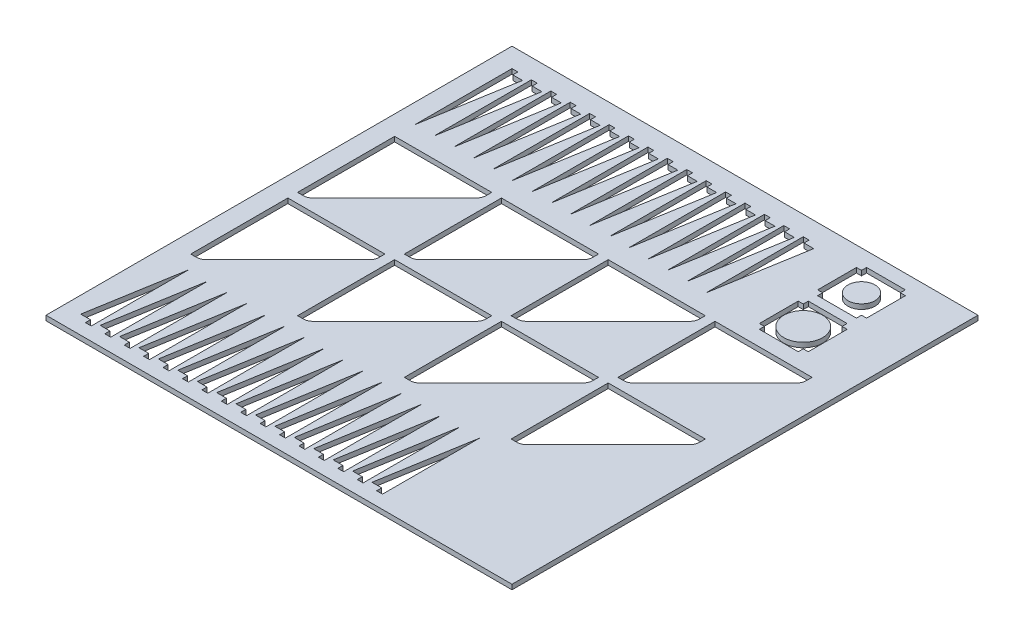
from build123d import *

# Parameters (mm, degrees)
SKETCH2_W               = 304.8
SKETCH2_H               = 304.8
BOSS_EXTRUDE1_DEPTH     = 3.175
CUT_EXTRUDE1_DEPTH      = 348.408852067
CUT_EXTRUDE1_DEPTH_BACK = 348.408852067
SKETCH3_R               = 8.89
SKETCH3_R_2             = 12.7


with BuildPart() as part:
    # Sketch2 → Boss-Extrude1 (new body)
    with BuildSketch(Plane(origin=(0, 0, 0), x_dir=(1, 0, 0), z_dir=(0, 1, 0))):
        with Locations((-56.763509666, -124.968808797)):
            Rectangle(SKETCH2_W, SKETCH2_H)
    extrude(amount=BOSS_EXTRUDE1_DEPTH)

    # Sketch3 → Cut-Extrude1 (cut, two sides: drawn at the far end of the back side and taken through both)
    # profile 1 of 42: a face of its own
    with BuildSketch(Plane(origin=(0, 3.175, 0), x_dir=(1, 0, 0), z_dir=(0, 1, 0)).offset(-CUT_EXTRUDE1_DEPTH_BACK)):
        Polygon((57.536490334, -10.668808797), (57.536490334, -13.970808797), (32.136490334, -13.970808797), (32.136490334, -10.668808797), (28.834490334, -10.668808797), (28.834490334, 14.731191203), (32.136490334, 14.731191203), (32.136490334, 18.033191203), (57.536490334, 18.033191203), (57.536490334, 14.731191203), (60.838490334, 14.731191203), (60.838490334, -10.668808797), align=None)
        with Locations(Location((44.836490334, 2.031191203, 0), (0, 0, 270))):
            Circle(SKETCH3_R, mode=Mode.SUBTRACT)
    # profile 2 of 42: a face of its own
    with BuildSketch(Plane(origin=(0, 3.175, 0), x_dir=(1, 0, 0), z_dir=(0, 1, 0)).offset(-CUT_EXTRUDE1_DEPTH_BACK)):
        Polygon((32.136490334, -23.368808797), (28.834490334, -23.368808797), (28.834490334, -48.768808797), (32.136490334, -48.768808797), (32.136490334, -52.070808797), (57.536490334, -52.070808797), (57.536490334, -48.768808797), (60.838490334, -48.768808797), (60.838490334, -23.368808797), (57.536490334, -23.368808797), (57.536490334, -20.066808797), (32.136490334, -20.066808797), align=None)
        with Locations(Location((44.836490334, -36.068808797, 0), (0, 0, 270))):
            Circle(SKETCH3_R_2, mode=Mode.SUBTRACT)
    # profile 3 of 42: a face of its own
    with BuildSketch(Plane(origin=(0, 3.175, 0), x_dir=(1, 0, 0), z_dir=(0, 1, 0)).offset(-CUT_EXTRUDE1_DEPTH_BACK)):
        Polygon((-196.463509666, -48.768808797), (-186.303509666, 11.429191203), (-192.653509666, 11.429191203), (-192.653509666, 14.731191203), (-196.463509666, 14.731191203), align=None)
    # profile 4 of 42: a face of its own
    with BuildSketch(Plane(origin=(0, 3.175, 0), x_dir=(1, 0, 0), z_dir=(0, 1, 0)).offset(-CUT_EXTRUDE1_DEPTH_BACK)):
        Polygon((2.246362274, -205.195366412), (-7.913637726, -265.393366412), (-1.563637726, -265.393366412), (-1.563637726, -268.695366412), (2.246362274, -268.695366412), align=None)
    # profile 5 of 42: a face of its own
    with BuildSketch(Plane(origin=(0, 3.175, 0), x_dir=(1, 0, 0), z_dir=(0, 1, 0)).offset(-CUT_EXTRUDE1_DEPTH_BACK)):
        Polygon((-183.763509666, 14.731191203), (-183.763509666, -48.768808797), (-173.603509666, 11.429191203), (-179.953509666, 11.429191203), (-179.953509666, 14.731191203), align=None)
    # profile 6 of 42: a face of its own
    with BuildSketch(Plane(origin=(0, 3.175, 0), x_dir=(1, 0, 0), z_dir=(0, 1, 0)).offset(-CUT_EXTRUDE1_DEPTH_BACK)):
        Polygon((-10.453637726, -205.195366412), (-20.613637726, -265.393366412), (-14.263637726, -265.393366412), (-14.263637726, -268.695366412), (-10.453637726, -268.695366412), align=None)
    # profile 7 of 42: a face of its own
    with BuildSketch(Plane(origin=(0, 3.175, 0), x_dir=(1, 0, 0), z_dir=(0, 1, 0)).offset(-CUT_EXTRUDE1_DEPTH_BACK)):
        Polygon((-171.063509666, 14.731191203), (-171.063509666, -48.768808797), (-160.903509666, 11.429191203), (-167.253509666, 11.429191203), (-167.253509666, 14.731191203), align=None)
    # profile 8 of 42: a face of its own
    with BuildSketch(Plane(origin=(0, 3.175, 0), x_dir=(1, 0, 0), z_dir=(0, 1, 0)).offset(-CUT_EXTRUDE1_DEPTH_BACK)):
        Polygon((-23.153637726, -205.195366412), (-33.313637726, -265.393366412), (-26.963637726, -265.393366412), (-26.963637726, -268.695366412), (-23.153637726, -268.695366412), align=None)
    # profile 9 of 42: a face of its own
    with BuildSketch(Plane(origin=(0, 3.175, 0), x_dir=(1, 0, 0), z_dir=(0, 1, 0)).offset(-CUT_EXTRUDE1_DEPTH_BACK)):
        Polygon((-158.363509666, 14.731191203), (-158.363509666, -48.768808797), (-148.203509666, 11.429191203), (-154.553509666, 11.429191203), (-154.553509666, 14.731191203), align=None)
    # profile 10 of 42: a face of its own
    with BuildSketch(Plane(origin=(0, 3.175, 0), x_dir=(1, 0, 0), z_dir=(0, 1, 0)).offset(-CUT_EXTRUDE1_DEPTH_BACK)):
        Polygon((-35.853637726, -205.195366412), (-46.013637726, -265.393366412), (-39.663637726, -265.393366412), (-39.663637726, -268.695366412), (-35.853637726, -268.695366412), align=None)
    # profile 11 of 42: a face of its own
    with BuildSketch(Plane(origin=(0, 3.175, 0), x_dir=(1, 0, 0), z_dir=(0, 1, 0)).offset(-CUT_EXTRUDE1_DEPTH_BACK)):
        Polygon((-145.663509666, 14.731191203), (-145.663509666, -48.768808797), (-135.503509666, 11.429191203), (-141.853509666, 11.429191203), (-141.853509666, 14.731191203), align=None)
    # profile 12 of 42: a face of its own
    with BuildSketch(Plane(origin=(0, 3.175, 0), x_dir=(1, 0, 0), z_dir=(0, 1, 0)).offset(-CUT_EXTRUDE1_DEPTH_BACK)):
        Polygon((-48.553637726, -205.195366412), (-58.713637726, -265.393366412), (-52.363637726, -265.393366412), (-52.363637726, -268.695366412), (-48.553637726, -268.695366412), align=None)
    # profile 13 of 42: a face of its own
    with BuildSketch(Plane(origin=(0, 3.175, 0), x_dir=(1, 0, 0), z_dir=(0, 1, 0)).offset(-CUT_EXTRUDE1_DEPTH_BACK)):
        Polygon((-132.963509666, 14.731191203), (-132.963509666, -48.768808797), (-122.803509666, 11.429191203), (-129.153509666, 11.429191203), (-129.153509666, 14.731191203), align=None)
    # profile 14 of 42: a face of its own
    with BuildSketch(Plane(origin=(0, 3.175, 0), x_dir=(1, 0, 0), z_dir=(0, 1, 0)).offset(-CUT_EXTRUDE1_DEPTH_BACK)):
        Polygon((-61.253637726, -205.195366412), (-71.413637726, -265.393366412), (-65.063637726, -265.393366412), (-65.063637726, -268.695366412), (-61.253637726, -268.695366412), align=None)
    # profile 15 of 42: a face of its own
    with BuildSketch(Plane(origin=(0, 3.175, 0), x_dir=(1, 0, 0), z_dir=(0, 1, 0)).offset(-CUT_EXTRUDE1_DEPTH_BACK)):
        Polygon((-120.263509666, 14.731191203), (-120.263509666, -48.768808797), (-110.103509666, 11.429191203), (-116.453509666, 11.429191203), (-116.453509666, 14.731191203), align=None)
    # profile 16 of 42: a face of its own
    with BuildSketch(Plane(origin=(0, 3.175, 0), x_dir=(1, 0, 0), z_dir=(0, 1, 0)).offset(-CUT_EXTRUDE1_DEPTH_BACK)):
        Polygon((-73.953637726, -205.195366412), (-84.113637726, -265.393366412), (-77.763637726, -265.393366412), (-77.763637726, -268.695366412), (-73.953637726, -268.695366412), align=None)
    # profile 17 of 42: a face of its own
    with BuildSketch(Plane(origin=(0, 3.175, 0), x_dir=(1, 0, 0), z_dir=(0, 1, 0)).offset(-CUT_EXTRUDE1_DEPTH_BACK)):
        Polygon((-107.563509666, 14.731191203), (-107.563509666, -48.768808797), (-97.403509666, 11.429191203), (-103.753509666, 11.429191203), (-103.753509666, 14.731191203), align=None)
    # profile 18 of 42: a face of its own
    with BuildSketch(Plane(origin=(0, 3.175, 0), x_dir=(1, 0, 0), z_dir=(0, 1, 0)).offset(-CUT_EXTRUDE1_DEPTH_BACK)):
        Polygon((-86.653637726, -205.195366412), (-96.813637726, -265.393366412), (-90.463637726, -265.393366412), (-90.463637726, -268.695366412), (-86.653637726, -268.695366412), align=None)
    # profile 19 of 42: a face of its own
    with BuildSketch(Plane(origin=(0, 3.175, 0), x_dir=(1, 0, 0), z_dir=(0, 1, 0)).offset(-CUT_EXTRUDE1_DEPTH_BACK)):
        Polygon((-94.863509666, 14.731191203), (-94.863509666, -48.768808797), (-84.703509666, 11.429191203), (-91.053509666, 11.429191203), (-91.053509666, 14.731191203), align=None)
    # profile 20 of 42: a face of its own
    with BuildSketch(Plane(origin=(0, 3.175, 0), x_dir=(1, 0, 0), z_dir=(0, 1, 0)).offset(-CUT_EXTRUDE1_DEPTH_BACK)):
        Polygon((-99.353637726, -205.195366412), (-109.513637726, -265.393366412), (-103.163637726, -265.393366412), (-103.163637726, -268.695366412), (-99.353637726, -268.695366412), align=None)
    # profile 21 of 42: a face of its own
    with BuildSketch(Plane(origin=(0, 3.175, 0), x_dir=(1, 0, 0), z_dir=(0, 1, 0)).offset(-CUT_EXTRUDE1_DEPTH_BACK)):
        Polygon((-82.163509666, 14.731191203), (-82.163509666, -48.768808797), (-72.003509666, 11.429191203), (-78.353509666, 11.429191203), (-78.353509666, 14.731191203), align=None)
    # profile 22 of 42: a face of its own
    with BuildSketch(Plane(origin=(0, 3.175, 0), x_dir=(1, 0, 0), z_dir=(0, 1, 0)).offset(-CUT_EXTRUDE1_DEPTH_BACK)):
        Polygon((-112.053637726, -205.195366412), (-122.213637726, -265.393366412), (-115.863637726, -265.393366412), (-115.863637726, -268.695366412), (-112.053637726, -268.695366412), align=None)
    # profile 23 of 42: a face of its own
    with BuildSketch(Plane(origin=(0, 3.175, 0), x_dir=(1, 0, 0), z_dir=(0, 1, 0)).offset(-CUT_EXTRUDE1_DEPTH_BACK)):
        Polygon((-69.463509666, 14.731191203), (-69.463509666, -48.768808797), (-59.303509666, 11.429191203), (-65.653509666, 11.429191203), (-65.653509666, 14.731191203), align=None)
    # profile 24 of 42: a face of its own
    with BuildSketch(Plane(origin=(0, 3.175, 0), x_dir=(1, 0, 0), z_dir=(0, 1, 0)).offset(-CUT_EXTRUDE1_DEPTH_BACK)):
        Polygon((-124.753637726, -205.195366412), (-134.913637726, -265.393366412), (-128.563637726, -265.393366412), (-128.563637726, -268.695366412), (-124.753637726, -268.695366412), align=None)
    # profile 25 of 42: a face of its own
    with BuildSketch(Plane(origin=(0, 3.175, 0), x_dir=(1, 0, 0), z_dir=(0, 1, 0)).offset(-CUT_EXTRUDE1_DEPTH_BACK)):
        Polygon((-56.763509666, 14.731191203), (-56.763509666, -48.768808797), (-46.603509666, 11.429191203), (-52.953509666, 11.429191203), (-52.953509666, 14.731191203), align=None)
    # profile 26 of 42: a face of its own
    with BuildSketch(Plane(origin=(0, 3.175, 0), x_dir=(1, 0, 0), z_dir=(0, 1, 0)).offset(-CUT_EXTRUDE1_DEPTH_BACK)):
        Polygon((-137.453637726, -205.195366412), (-147.613637726, -265.393366412), (-141.263637726, -265.393366412), (-141.263637726, -268.695366412), (-137.453637726, -268.695366412), align=None)
    # profile 27 of 42: a face of its own
    with BuildSketch(Plane(origin=(0, 3.175, 0), x_dir=(1, 0, 0), z_dir=(0, 1, 0)).offset(-CUT_EXTRUDE1_DEPTH_BACK)):
        Polygon((-44.063509666, 14.731191203), (-44.063509666, -48.768808797), (-33.903509666, 11.429191203), (-40.253509666, 11.429191203), (-40.253509666, 14.731191203), align=None)
    # profile 28 of 42: a face of its own
    with BuildSketch(Plane(origin=(0, 3.175, 0), x_dir=(1, 0, 0), z_dir=(0, 1, 0)).offset(-CUT_EXTRUDE1_DEPTH_BACK)):
        Polygon((-150.153637726, -205.195366412), (-160.313637726, -265.393366412), (-153.963637726, -265.393366412), (-153.963637726, -268.695366412), (-150.153637726, -268.695366412), align=None)
    # profile 29 of 42: a face of its own
    with BuildSketch(Plane(origin=(0, 3.175, 0), x_dir=(1, 0, 0), z_dir=(0, 1, 0)).offset(-CUT_EXTRUDE1_DEPTH_BACK)):
        Polygon((-31.363509666, 14.731191203), (-31.363509666, -48.768808797), (-21.203509666, 11.429191203), (-27.553509666, 11.429191203), (-27.553509666, 14.731191203), align=None)
    # profile 30 of 42: a face of its own
    with BuildSketch(Plane(origin=(0, 3.175, 0), x_dir=(1, 0, 0), z_dir=(0, 1, 0)).offset(-CUT_EXTRUDE1_DEPTH_BACK)):
        Polygon((-162.853637726, -205.195366412), (-173.013637726, -265.393366412), (-166.663637726, -265.393366412), (-166.663637726, -268.695366412), (-162.853637726, -268.695366412), align=None)
    # profile 31 of 42: a face of its own
    with BuildSketch(Plane(origin=(0, 3.175, 0), x_dir=(1, 0, 0), z_dir=(0, 1, 0)).offset(-CUT_EXTRUDE1_DEPTH_BACK)):
        Polygon((-18.663509666, 14.731191203), (-18.663509666, -48.768808797), (-8.503509666, 11.429191203), (-14.853509666, 11.429191203), (-14.853509666, 14.731191203), align=None)
    # profile 32 of 42: a face of its own
    with BuildSketch(Plane(origin=(0, 3.175, 0), x_dir=(1, 0, 0), z_dir=(0, 1, 0)).offset(-CUT_EXTRUDE1_DEPTH_BACK)):
        Polygon((-175.553637726, -205.195366412), (-185.713637726, -265.393366412), (-179.363637726, -265.393366412), (-179.363637726, -268.695366412), (-175.553637726, -268.695366412), align=None)
    # profile 33 of 42: a face of its own
    with BuildSketch(Plane(origin=(0, 3.175, 0), x_dir=(1, 0, 0), z_dir=(0, 1, 0)).offset(-CUT_EXTRUDE1_DEPTH_BACK)):
        Polygon((-5.963509666, 14.731191203), (-5.963509666, -48.768808797), (4.196490334, 11.429191203), (-2.153509666, 11.429191203), (-2.153509666, 14.731191203), align=None)
    # profile 34 of 42: a face of its own
    with BuildSketch(Plane(origin=(0, 3.175, 0), x_dir=(1, 0, 0), z_dir=(0, 1, 0)).offset(-CUT_EXTRUDE1_DEPTH_BACK)):
        Polygon((-188.253637726, -205.195366412), (-198.413637726, -265.393366412), (-192.063637726, -265.393366412), (-192.063637726, -268.695366412), (-188.253637726, -268.695366412), align=None)
    # profile 35 of 42: a face of its own
    with BuildSketch(Plane(origin=(0, 3.175, 0), x_dir=(1, 0, 0), z_dir=(0, 1, 0)).offset(-CUT_EXTRUDE1_DEPTH_BACK)):
        with BuildLine():
            Line((-196.463509666, -62.03034668), (-132.963509666, -62.03034668))
            Line((-132.963509666, -62.03034668), (-132.963509666, -65.750090559))
            ThreePointArc((-132.963509666, -65.750090559), (-133.446874634, -68.180130355), (-134.823381605, -70.24021862))
            Line((-134.823381605, -70.24021862), (-188.253637726, -123.670474741))
            ThreePointArc((-188.253637726, -123.670474741), (-190.313725991, -125.046981712), (-192.743765787, -125.53034668))
            Line((-192.743765787, -125.53034668), (-196.463509666, -125.53034668))
            Line((-196.463509666, -125.53034668), (-196.463509666, -62.03034668))
        make_face()
    # profile 36 of 42: a face of its own
    with BuildSketch(Plane(origin=(0, 3.175, 0), x_dir=(1, 0, 0), z_dir=(0, 1, 0)).offset(-CUT_EXTRUDE1_DEPTH_BACK)):
        with BuildLine():
            Line((-126.613509666, -62.03034668), (-63.113509666, -62.03034668))
            Line((-63.113509666, -62.03034668), (-63.113509666, -65.750090559))
            ThreePointArc((-63.113509666, -65.750090559), (-63.596874634, -68.180130355), (-64.973381605, -70.24021862))
            Line((-64.973381605, -70.24021862), (-118.403637726, -123.670474741))
            ThreePointArc((-118.403637726, -123.670474741), (-120.463725991, -125.046981712), (-122.893765787, -125.53034668))
            Line((-122.893765787, -125.53034668), (-126.613509666, -125.53034668))
            Line((-126.613509666, -125.53034668), (-126.613509666, -62.03034668))
        make_face()
    # profile 37 of 42: a face of its own
    with BuildSketch(Plane(origin=(0, 3.175, 0), x_dir=(1, 0, 0), z_dir=(0, 1, 0)).offset(-CUT_EXTRUDE1_DEPTH_BACK)):
        with BuildLine():
            Line((-56.763509666, -62.03034668), (6.736490334, -62.03034668))
            Line((6.736490334, -62.03034668), (6.736490334, -65.750090559))
            ThreePointArc((6.736490334, -65.750090559), (6.253125366, -68.180130355), (4.876618395, -70.24021862))
            Line((4.876618395, -70.24021862), (-48.553637726, -123.670474741))
            ThreePointArc((-48.553637726, -123.670474741), (-50.613725991, -125.046981712), (-53.043765787, -125.53034668))
            Line((-53.043765787, -125.53034668), (-56.763509666, -125.53034668))
            Line((-56.763509666, -125.53034668), (-56.763509666, -62.03034668))
        make_face()
    # profile 38 of 42: a face of its own
    with BuildSketch(Plane(origin=(0, 3.175, 0), x_dir=(1, 0, 0), z_dir=(0, 1, 0)).offset(-CUT_EXTRUDE1_DEPTH_BACK)):
        with BuildLine():
            Line((13.086490334, -62.03034668), (76.586490334, -62.03034668))
            Line((76.586490334, -62.03034668), (76.586490334, -65.750090559))
            ThreePointArc((76.586490334, -65.750090559), (76.103125366, -68.180130355), (74.726618395, -70.24021862))
            Line((74.726618395, -70.24021862), (21.296362274, -123.670474741))
            ThreePointArc((21.296362274, -123.670474741), (19.236274009, -125.046981712), (16.806234213, -125.53034668))
            Line((16.806234213, -125.53034668), (13.086490334, -125.53034668))
            Line((13.086490334, -125.53034668), (13.086490334, -62.03034668))
        make_face()
    # profile 39 of 42: a face of its own
    with BuildSketch(Plane(origin=(0, 3.175, 0), x_dir=(1, 0, 0), z_dir=(0, 1, 0)).offset(-CUT_EXTRUDE1_DEPTH_BACK)):
        with BuildLine():
            Line((-132.963509666, -131.88034668), (-132.963509666, -135.600090559))
            ThreePointArc((-132.963509666, -135.600090559), (-133.446874634, -138.030130355), (-134.823381605, -140.09021862))
            Line((-134.823381605, -140.09021862), (-188.253637726, -193.520474741))
            ThreePointArc((-188.253637726, -193.520474741), (-190.313725991, -194.896981712), (-192.743765787, -195.38034668))
            Line((-192.743765787, -195.38034668), (-196.463509666, -195.38034668))
            Line((-196.463509666, -195.38034668), (-196.463509666, -131.88034668))
            Line((-196.463509666, -131.88034668), (-132.963509666, -131.88034668))
        make_face()
    # profile 40 of 42: a face of its own
    with BuildSketch(Plane(origin=(0, 3.175, 0), x_dir=(1, 0, 0), z_dir=(0, 1, 0)).offset(-CUT_EXTRUDE1_DEPTH_BACK)):
        with BuildLine():
            Line((-126.613509666, -131.88034668), (-63.113509666, -131.88034668))
            Line((-63.113509666, -131.88034668), (-63.113509666, -135.600090559))
            ThreePointArc((-63.113509666, -135.600090559), (-63.596874634, -138.030130355), (-64.973381605, -140.09021862))
            Line((-64.973381605, -140.09021862), (-118.403637726, -193.520474741))
            ThreePointArc((-118.403637726, -193.520474741), (-120.463725991, -194.896981712), (-122.893765787, -195.38034668))
            Line((-122.893765787, -195.38034668), (-126.613509666, -195.38034668))
            Line((-126.613509666, -195.38034668), (-126.613509666, -131.88034668))
        make_face()
    # profile 41 of 42: a face of its own
    with BuildSketch(Plane(origin=(0, 3.175, 0), x_dir=(1, 0, 0), z_dir=(0, 1, 0)).offset(-CUT_EXTRUDE1_DEPTH_BACK)):
        with BuildLine():
            Line((-56.763509666, -131.88034668), (6.736490334, -131.88034668))
            Line((6.736490334, -131.88034668), (6.736490334, -135.600090559))
            ThreePointArc((6.736490334, -135.600090559), (6.253125366, -138.030130355), (4.876618395, -140.09021862))
            Line((4.876618395, -140.09021862), (-48.553637726, -193.520474741))
            ThreePointArc((-48.553637726, -193.520474741), (-50.613725991, -194.896981712), (-53.043765787, -195.38034668))
            Line((-53.043765787, -195.38034668), (-56.763509666, -195.38034668))
            Line((-56.763509666, -195.38034668), (-56.763509666, -131.88034668))
        make_face()
    # profile 42 of 42: a face of its own
    with BuildSketch(Plane(origin=(0, 3.175, 0), x_dir=(1, 0, 0), z_dir=(0, 1, 0)).offset(-CUT_EXTRUDE1_DEPTH_BACK)):
        with BuildLine():
            Line((13.086490334, -131.88034668), (76.586490334, -131.88034668))
            Line((76.586490334, -131.88034668), (76.586490334, -135.600090559))
            ThreePointArc((76.586490334, -135.600090559), (76.103125366, -138.030130355), (74.726618395, -140.09021862))
            Line((74.726618395, -140.09021862), (21.296362274, -193.520474741))
            ThreePointArc((21.296362274, -193.520474741), (19.236274009, -194.896981712), (16.806234213, -195.38034668))
            Line((16.806234213, -195.38034668), (13.086490334, -195.38034668))
            Line((13.086490334, -195.38034668), (13.086490334, -131.88034668))
        make_face()
    extrude(amount=CUT_EXTRUDE1_DEPTH + CUT_EXTRUDE1_DEPTH_BACK, mode=Mode.SUBTRACT)


with BuildPart() as cut_extrude1_piece_1:
    # of the separate pieces the step leaves, piece 1, a body of its own (cut_extrude1_pieces)
    add(part.part.solids().sort_by_distance((-209.163509666, 0, 277.368808797))[0])


with BuildPart() as cut_extrude1_piece_2:
    # of the separate pieces the step leaves, piece 2, a body of its own (cut_extrude1_pieces)
    add(part.part.solids().sort_by_distance((44.836490334, 0, 48.768808797))[0])


with BuildPart() as cut_extrude1_piece_3:
    # of the separate pieces the step leaves, piece 3, a body of its own (cut_extrude1_pieces)
    add(part.part.solids().sort_by_distance((44.836490334, 0, 6.858808797))[0])


solid = Compound([cut_extrude1_piece_1.part, cut_extrude1_piece_2.part, cut_extrude1_piece_3.part])
